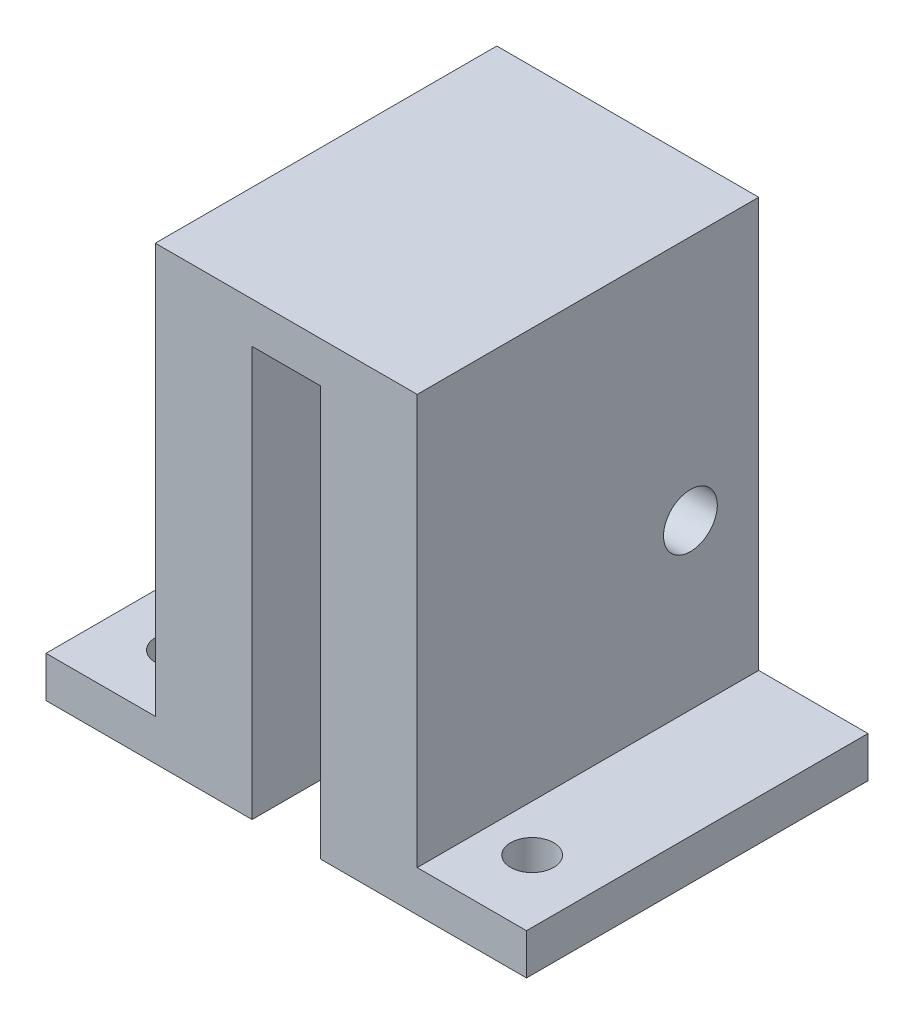
from build123d import *

# Parameters (mm, degrees)
BOSS_EXTRUDE1_DEPTH = 31.75
SKETCH2_R           = 2
CUT_EXTRUDE1_DEPTH  = 58.12585076
CUT_EXTRUDE2_REACH  = 62.42
SKETCH3_W           = 4.4
SKETCH3_H           = 2.771281292
CUT_EXTRUDE3_START  = -9
CUT_EXTRUDE3_DEPTH  = 9
CUT_EXTRUDE4_REACH  = 62.42
SKETCH5_R           = 2.5


with BuildPart() as part:
    # Sketch1 → Boss-Extrude1 (new body)
    with BuildSketch(Plane.XY):
        Polygon((-3.175, 0), (3.175, 0), (3.175, -38.1), (22.335, -38.1), (22.335, -34.29), (12.175, -34.29), (12.175, 3.81), (-12.175, 3.81), (-12.175, -34.29), (-22.335, -34.29), (-22.335, -38.1), (-3.175, -38.1), align=None)
    extrude(amount=BOSS_EXTRUDE1_DEPTH)

    # Sketch2 → Cut-Extrude1 (cut, through all)
    with BuildSketch(Plane.XZ.offset(38.1)):
        with Locations(Location((-16.51, 25.4, 0), (0, 0, 270))):
            Circle(SKETCH2_R)
        with Locations(Location((16.51, 25.4, 0), (0, 0, 270))):
            Circle(SKETCH2_R)
    extrude(amount=-CUT_EXTRUDE1_DEPTH, mode=Mode.SUBTRACT)

    # Sketch3 → Cut-Extrude2 (cut, up to next)
    with BuildSketch(Plane.ZY.offset(12.175), mode=Mode.PRIVATE) as cut_extrude2_sk1:
        with Locations((6.35, -19.05)):
            Rectangle(SKETCH3_W, SKETCH3_H)
    cut_extrude2_tool1 = extrude(cut_extrude2_sk1.sketch, amount=-CUT_EXTRUDE2_REACH, mode=Mode.PRIVATE) & part.part
    add(cut_extrude2_tool1.solids().sort_by_distance((-12.175, -19.05, 6.35))[0], mode=Mode.SUBTRACT)

    # Sketch4 → Cut-Extrude3 (cut)
    with BuildSketch(Plane.ZY.offset(12.175).offset(CUT_EXTRUDE3_START)):
        with BuildLine():
            Line((4.15, -20.435640646), (4.15, -17.664359354))
            ThreePointArc((4.15, -17.664359354), (6.35, -16.45), (8.55, -17.664359354))
            Line((8.55, -17.664359354), (8.55, -20.435640646))
            ThreePointArc((8.55, -20.435640646), (6.35, -21.65), (4.15, -20.435640646))
        make_face()
    extrude(amount=CUT_EXTRUDE3_DEPTH, mode=Mode.SUBTRACT)

    # Sketch5 → Cut-Extrude4 (cut, up to next)
    with BuildSketch(Plane(origin=(12.175, 0, 0), x_dir=(0, 0, -1), z_dir=(1, 0, 0)), mode=Mode.PRIVATE) as cut_extrude4_sk1:
        with Locations(Location((-6.35, -19.05, 0), (0, 0, 90))):
            Circle(SKETCH5_R)
    cut_extrude4_tool1 = extrude(cut_extrude4_sk1.sketch, amount=-CUT_EXTRUDE4_REACH, mode=Mode.PRIVATE) & part.part
    add(cut_extrude4_tool1.solids().sort_by_distance((12.175, -19.05, 6.35))[0], mode=Mode.SUBTRACT)


solid = part.part
